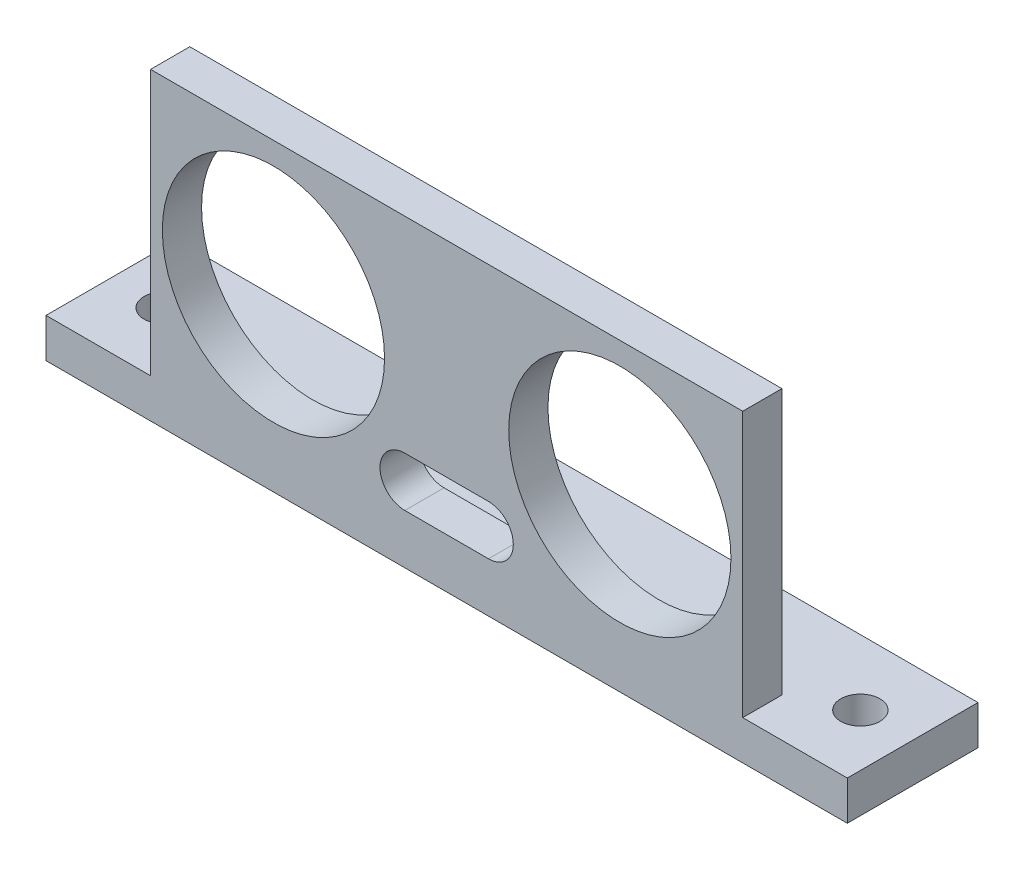
from build123d import *

# Parameters (mm, degrees)
SKETCH1_W               = 170
SKETCH1_H               = 3
BOSS_EXTRUDE1_DEPTH     = 10
SKETCH4_R               = 1.2
CUT_EXTRUDE1_DEPTH      = 21
SKETCH2_W               = 45.3
SKETCH2_H               = 3
BOSS_EXTRUDE6_DEPTH     = 20.3
SKETCH5_R               = 8.5
CUT_EXTRUDE2_DEPTH      = 20.3
SKETCH6_W               = 45.3
SKETCH6_H               = 3
BOSS_EXTRUDE7_DEPTH     = 20.3
SKETCH7_R               = 8.5
CUT_EXTRUDE3_DEPTH      = 100.885733504
CUT_EXTRUDE5_DEPTH      = 102.201856693
CUT_EXTRUDE5_DEPTH_BACK = 102.201856693
SKETCH12_W              = 88.7
SKETCH12_H              = 17.241657791
CUT_EXTRUDE6_DEPTH      = 75.862735481
CUT_EXTRUDE6_DEPTH_BACK = 75.862735481
SKETCH13_W              = 37.135878318
SKETCH13_H              = 38.462159687
SKETCH13_W_2            = 38.462159687
SKETCH13_H_2            = 47.746129266
SKETCH15_W              = 8
SKETCH15_H              = 10
BOSS_EXTRUDE9_DEPTH     = 3
CUT_EXTRUDE7_DEPTH      = 67.392895801
CUT_EXTRUDE7_DEPTH_BACK = 67.392895801
SKETCH16_R              = 1.5


with BuildPart() as part:
    # Sketch1 → Boss-Extrude1 (new body)
    with BuildSketch(Plane.XY):
        with Locations((13.639372454, -9.657761352)):
            Rectangle(SKETCH1_W, SKETCH1_H)
    extrude(amount=BOSS_EXTRUDE1_DEPTH)

    # Sketch4 → Cut-Extrude1 (cut)
    with BuildSketch(Plane(origin=(0, -8.157761352, 0), x_dir=(1, 0, 0), z_dir=(0, 1, 0))):
        with Locations(Location((-63.360627546, -4.938536908, 0), (0, 0, 180))):
            Circle(SKETCH4_R)
        with Locations(Location((90.639372454, -5.283238547, 0), (0, 0, 180))):
            Circle(SKETCH4_R)
    extrude(amount=-CUT_EXTRUDE1_DEPTH, mode=Mode.SUBTRACT)

    # Sketch2 → Boss-Extrude6 (add)
    with BuildSketch(Plane(origin=(0, -8.157761352, 0), x_dir=(1, 0, 0), z_dir=(0, 1, 0))):
        with Locations((-30.710627546, -8.5)):
            Rectangle(SKETCH2_W, SKETCH2_H)
    extrude(amount=BOSS_EXTRUDE6_DEPTH)

    # Sketch5 → Cut-Extrude2 (cut)
    with BuildSketch(Plane(origin=(0, 0, 7), x_dir=(-1, 0, 0), z_dir=(0, 0, -1))):
        with Locations((17.460627546, 1.942238648)):
            Circle(SKETCH5_R)
        with Locations((43.960627546, 1.942238648)):
            Circle(SKETCH5_R)
        with BuildLine():
            Line((27.510627546, -3.557761352), (33.910627546, -3.557761352))
            ThreePointArc((33.910627546, -3.557761352), (35.810627546, -5.457761352), (33.910627546, -7.357761352))
            Line((33.910627546, -7.357761352), (27.510627546, -7.357761352))
            ThreePointArc((27.510627546, -7.357761352), (25.610627546, -5.457761352), (27.510627546, -3.557761352))
        make_face()
    extrude(amount=-CUT_EXTRUDE2_DEPTH, mode=Mode.SUBTRACT)

    # Sketch6 → Boss-Extrude7 (add)
    with BuildSketch(Plane(origin=(0, -8.157761352, 0), x_dir=(1, 0, 0), z_dir=(0, 1, 0))):
        with Locations((57.989372454, -8.5)):
            Rectangle(SKETCH6_W, SKETCH6_H)
    extrude(amount=BOSS_EXTRUDE7_DEPTH)

    # Sketch7 → Cut-Extrude3 (cut, through all)
    with BuildSketch(Plane.XY.offset(10)):
        with Locations((44.739372454, 1.942238648)):
            Circle(SKETCH7_R)
        with Locations((71.239372454, 1.942238648)):
            Circle(SKETCH7_R)
        with BuildLine():
            Line((54.839372454, -3.557761352), (61.239372454, -3.557761352))
            ThreePointArc((61.239372454, -3.557761352), (63.139372454, -5.457761352), (61.239372454, -7.357761352))
            Line((61.239372454, -7.357761352), (54.839372454, -7.357761352))
            ThreePointArc((54.839372454, -7.357761352), (52.939372454, -5.457761352), (54.839372454, -3.557761352))
        make_face()
    extrude(amount=-CUT_EXTRUDE3_DEPTH, mode=Mode.SUBTRACT)

    # Sketch12 → Cut-Extrude5 (cut, two sides: drawn at the far end of the back side and taken through both)
    with BuildSketch(Plane(origin=(0, -8.157761352, 0), x_dir=(1, 0, 0), z_dir=(0, 1, 0)).offset(-CUT_EXTRUDE5_DEPTH_BACK)):
        with Locations((54.289372454, -4.61843826)):
            Rectangle(SKETCH12_W, SKETCH12_H)
    extrude(amount=CUT_EXTRUDE5_DEPTH + CUT_EXTRUDE5_DEPTH_BACK, mode=Mode.SUBTRACT)

    # Sketch13 → Cut-Extrude6 (cut, two sides: drawn at the far end of the back side and taken through both)
    with BuildSketch(Plane(origin=(0, -8.157761352, 0), x_dir=(1, 0, 0), z_dir=(0, 1, 0)).offset(-CUT_EXTRUDE6_DEPTH_BACK)):
        with Locations((-71.928566705, 3.983905185)):
            Rectangle(SKETCH13_W, SKETCH13_H)
        with Locations((11.170452297, -17.070811541)):
            Rectangle(SKETCH13_W_2, SKETCH13_H_2)
    extrude(amount=CUT_EXTRUDE6_DEPTH + CUT_EXTRUDE6_DEPTH_BACK, mode=Mode.SUBTRACT)

    # Sketch15 → Boss-Extrude9 (add)
    with BuildSketch(Plane.XZ.offset(11.157761352)):
        with Locations((-57.360627546, 5)):
            Rectangle(SKETCH15_W, SKETCH15_H)
        with Locations((-4.060627546, 5)):
            Rectangle(SKETCH15_W, SKETCH15_H)
    extrude(amount=-BOSS_EXTRUDE9_DEPTH)

    # Sketch16 → Cut-Extrude7 (cut, two sides: drawn at the far end of the back side and taken through both)
    with BuildSketch(Plane(origin=(0, -11.157761352, 0), x_dir=(-1, 0, 0), z_dir=(0, -1, 0)).offset(-CUT_EXTRUDE7_DEPTH_BACK)):
        with Locations(Location((57.360627546, -5, 0), (0, 0, 180))):
            Circle(SKETCH16_R)
        with Locations(Location((4.060627546, -5, 0), (0, 0, 180))):
            Circle(SKETCH16_R)
    extrude(amount=CUT_EXTRUDE7_DEPTH + CUT_EXTRUDE7_DEPTH_BACK, mode=Mode.SUBTRACT)


solid = part.part
